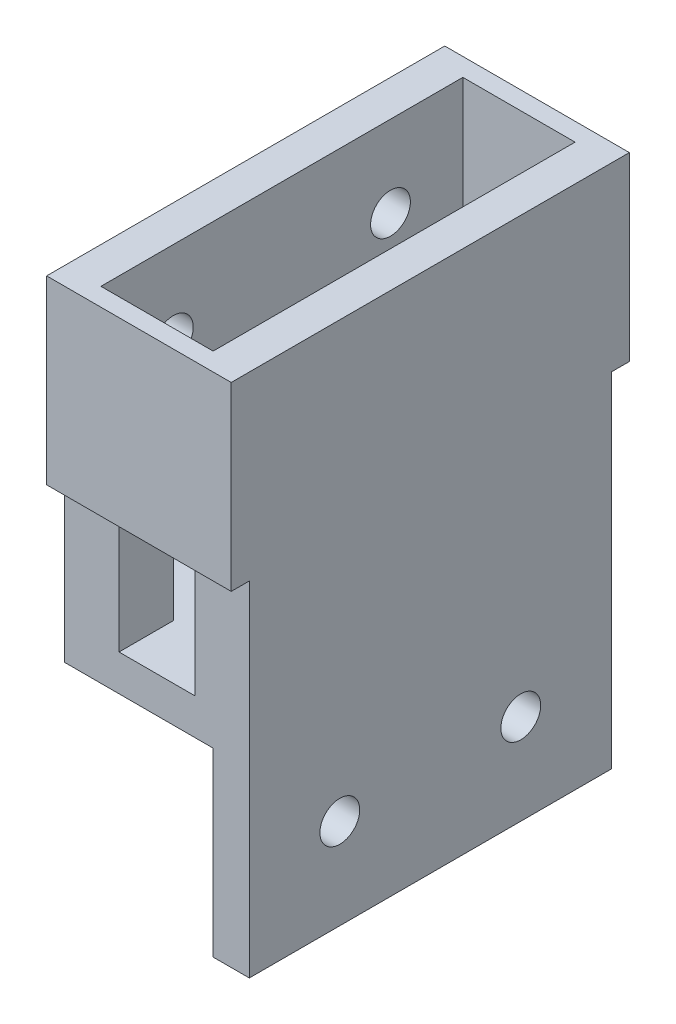
from build123d import *

# Parameters (mm, degrees)
BOSS_EXTRUDE1_DEPTH  = 20
SKETCH2_W            = 14
SKETCH2_H            = 4
CUT_EXTRUDE1_DEPTH   = 3
SKETCH9_W            = 10.2
SKETCH9_H            = 1
BOSS_EXTRUDE11_DEPTH = 10
SKETCH10_R           = 1.1
CUT_EXTRUDE2_DEPTH   = 5
SKETCH11_R           = 1.1
CUT_EXTRUDE3_DEPTH   = 5


with BuildPart() as part:
    # Sketch1 → Boss-Extrude1 (new body)
    with BuildSketch(Plane.XY):
        Polygon((0, 11), (0, -8), (8.2, -8), (8.2, -18), (10.2, -18), (10.2, -6), (10.2, 11), (8.2, 11), (8.2, 2), (7.2, 2), (7.2, -6), (3, -6), (3, 2), (2, 2), (2, 11), align=None)
    extrude(amount=BOSS_EXTRUDE1_DEPTH)

    # Sketch2 → Cut-Extrude1 (cut)
    with BuildSketch(Plane.ZY):
        with Locations((10, -4)):
            Rectangle(SKETCH2_W, SKETCH2_H)
    extrude(amount=-CUT_EXTRUDE1_DEPTH, mode=Mode.SUBTRACT)

    # Sketch9 → Boss-Extrude11 (add)
    with BuildSketch(Plane(origin=(0, 11, 0), x_dir=(1, 0, 0), z_dir=(0, 1, 0))):
        with Locations((5.1, 0.5)):
            Rectangle(SKETCH9_W, SKETCH9_H)
        with Locations((5.1, -20.5)):
            Rectangle(SKETCH9_W, SKETCH9_H)
    extrude(amount=-BOSS_EXTRUDE11_DEPTH)

    # Sketch10 → Cut-Extrude2 (cut)
    with BuildSketch(Plane.ZY):
        with Locations(Location((4, 6.5, 0), (0, 0, 270))):
            Circle(SKETCH10_R)
        with Locations(Location((16, 6.5, 0), (0, 0, 270))):
            Circle(SKETCH10_R)
    extrude(amount=-CUT_EXTRUDE2_DEPTH, mode=Mode.SUBTRACT)

    # Sketch11 → Cut-Extrude3 (cut)
    with BuildSketch(Plane.ZY.offset(-8.2)):
        with Locations((5, -13)):
            Circle(SKETCH11_R)
        with Locations((15, -13)):
            Circle(SKETCH11_R)
    extrude(amount=-CUT_EXTRUDE3_DEPTH, mode=Mode.SUBTRACT)


solid = part.part
